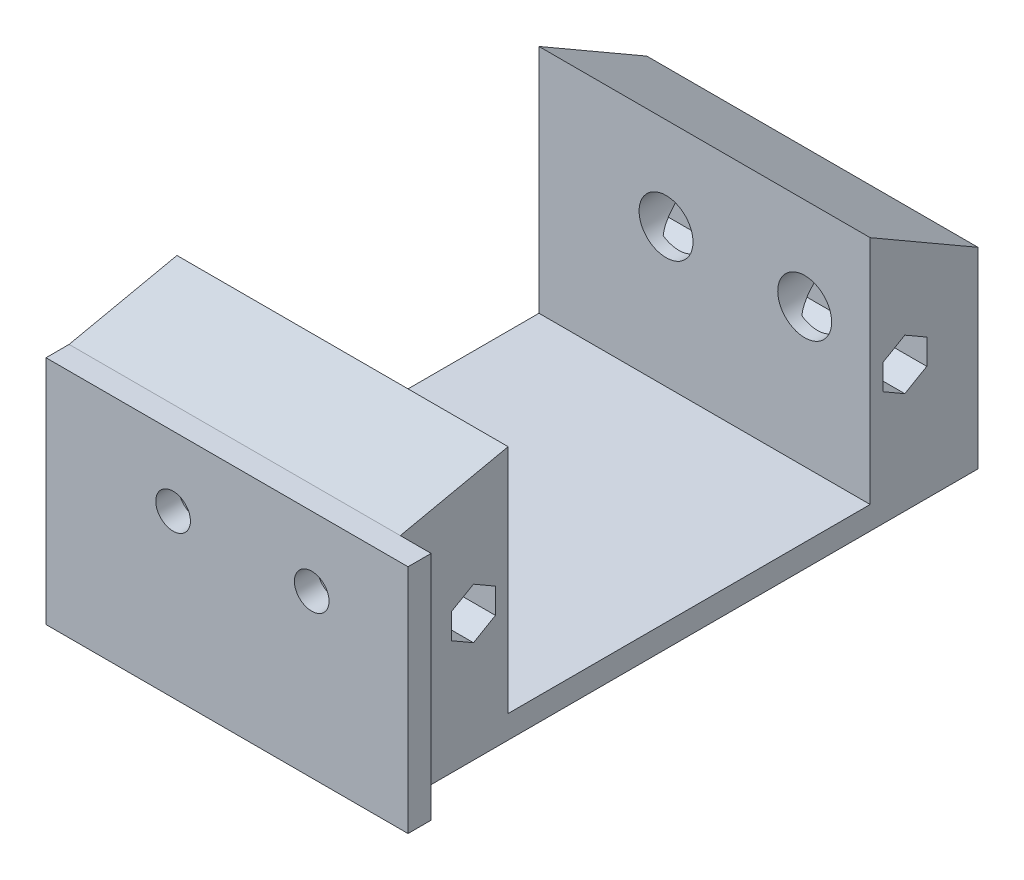
from build123d import *

# Parameters (mm, degrees)
SKETCH1_W           = 47
SKETCH1_H           = 30
SKETCH1_R           = 2.25
BOSS_EXTRUDE1_DEPTH = 3
SKETCH2_R           = 1.9
BOSS_EXTRUDE2_DEPTH = 43
CUT_EXTRUDE1_REACH  = 98.861
SKETCH3_R           = 3.5
CUT_EXTRUDE2_DEPTH  = 39


with BuildPart() as part:
    # Sketch1 → Boss-Extrude1 (new body)
    with BuildSketch(Plane.XY):
        with Locations((23.5, 15)):
            Rectangle(SKETCH1_W, SKETCH1_H)
        with Locations((16.5, 21)):
            Circle(SKETCH1_R, mode=Mode.SUBTRACT)
        with Locations((34.5, 21)):
            Circle(SKETCH1_R, mode=Mode.SUBTRACT)
    extrude(amount=BOSS_EXTRUDE1_DEPTH)

    # Sketch2 → Boss-Extrude2 (add)
    # profile 1 of 3: a face of its own
    with BuildSketch(Plane.ZY):
        Polygon((-75, 24.917096231), (-75, 3), (-61, 3), (-61, 33), align=None)
        with Locations(Location((-65.5, 16.5, 0), (0, 0, 270))):
            Circle(SKETCH2_R, mode=Mode.SUBTRACT)
    # profile 2 of 3: a face of its own
    with BuildSketch(Plane.ZY):
        Polygon((-75, 0), (0, 0), (0, 3), (-14, 3), (-61, 3), (-75, 3), align=None)
    # profile 3 of 3: a face of its own
    with BuildSketch(Plane.ZY):
        Polygon((-14, 3), (0, 3), (0, 30), (-14, 33), align=None)
        with Locations(Location((-9.5, 16.5, 0), (0, 0, 270))):
            Circle(SKETCH2_R, mode=Mode.SUBTRACT)
    extrude(amount=-BOSS_EXTRUDE2_DEPTH)

    # Cut-Extrude1: up to this face of the body (flat: up to its plane)
    cut_extrude1_end = Plane(part.part.faces().sort_by_distance((45, 15, 0))[0])
    # Sketch3 → Cut-Extrude1 (cut, up to the picked face)
    with BuildSketch(Plane(origin=(0, 0, -75), x_dir=(-1, 0, 0), z_dir=(0, 0, -1)), mode=Mode.PRIVATE) as cut_extrude1_sk1:
        with Locations((-34.5, 21)):
            Circle(SKETCH3_R)
    cut_extrude1_tool1 = split(extrude(cut_extrude1_sk1.sketch, amount=-CUT_EXTRUDE1_REACH, mode=Mode.PRIVATE), bisect_by=cut_extrude1_end, keep=Keep.BOTH, mode=Mode.PRIVATE)
    # Sketch3 → Cut-Extrude1 (cut, up to the picked face)
    with BuildSketch(Plane(origin=(0, 0, -75), x_dir=(-1, 0, 0), z_dir=(0, 0, -1)), mode=Mode.PRIVATE) as cut_extrude1_sk2:
        with Locations((-16.5, 21)):
            Circle(SKETCH3_R)
    cut_extrude1_tool2 = split(extrude(cut_extrude1_sk2.sketch, amount=-CUT_EXTRUDE1_REACH, mode=Mode.PRIVATE), bisect_by=cut_extrude1_end, keep=Keep.BOTH, mode=Mode.PRIVATE)
    add(cut_extrude1_tool1.solids().sort_by(Axis((34.5, 21, -75), (0, 0, 1)))[0], mode=Mode.SUBTRACT)
    add(cut_extrude1_tool2.solids().sort_by(Axis((16.5, 21, -75), (0, 0, 1)))[0], mode=Mode.SUBTRACT)

    # Sketch4 → Cut-Extrude2 (cut)
    with BuildSketch(Plane(origin=(43, 0, 0), x_dir=(0, 0, -1), z_dir=(1, 0, 0))):
        Polygon((9.5, 13.209103466), (12.35, 14.854551733), (12.35, 18.145448267), (9.5, 19.790896534), (6.65, 18.145448267), (6.65, 14.854551733), align=None)
        Polygon((65.5, 13.209103466), (68.35, 14.854551733), (68.35, 18.145448267), (65.5, 19.790896534), (62.65, 18.145448267), (62.65, 14.854551733), align=None)
    extrude(amount=-CUT_EXTRUDE2_DEPTH, mode=Mode.SUBTRACT)


solid = part.part
